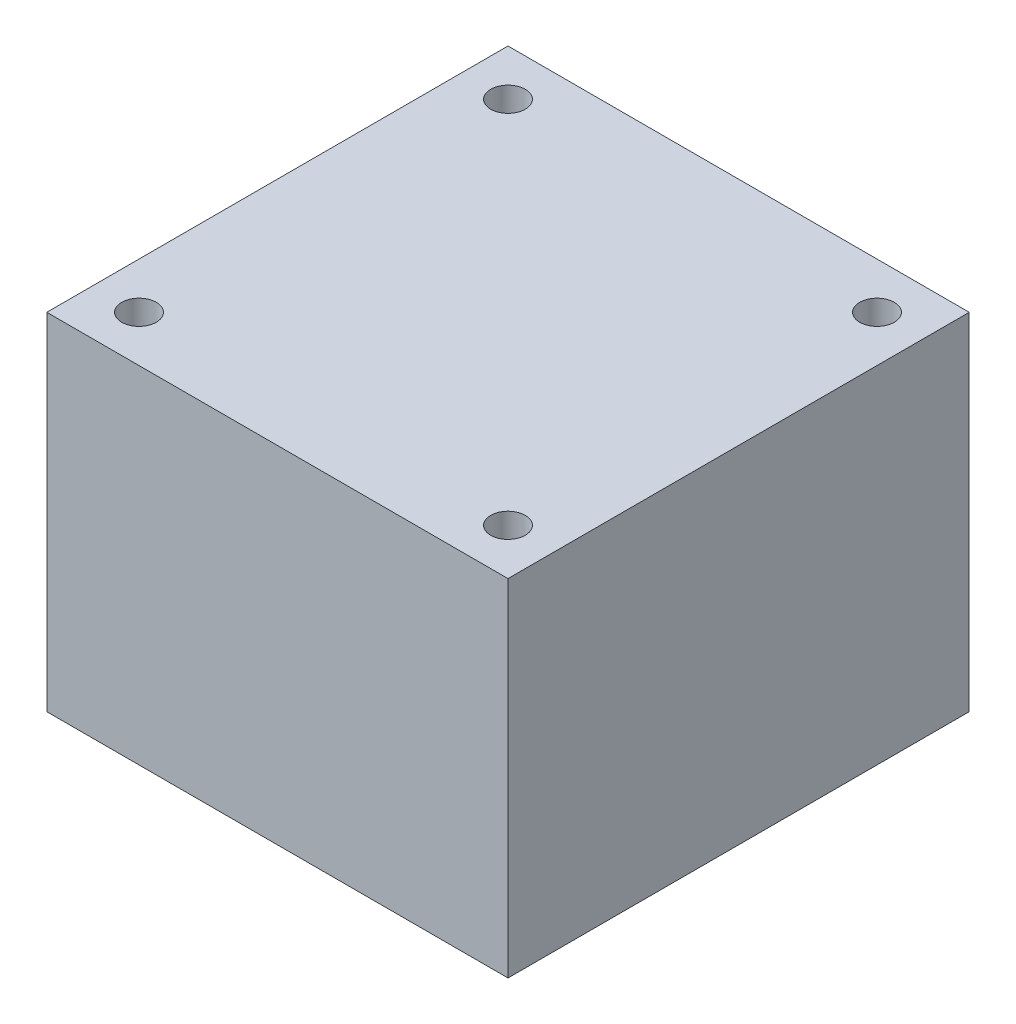
from build123d import *

# Parameters (mm, degrees)
SKETCH_1_W          = 40
SKETCH_1_H          = 40
EXTRUDE_1_DEPTH     = 30
SKETCH_2_R          = 1.5
CUT_EXTRUDE_1_DEPTH = 42.231056256


with BuildPart() as part:
    # 草图1 → 凸台-拉伸1 (new body)
    with BuildSketch(Plane(origin=(0, 0, 0), x_dir=(1, 0, 0), z_dir=(0, 1, 0))):
        Rectangle(SKETCH_1_W, SKETCH_1_H)
    extrude(amount=EXTRUDE_1_DEPTH)

    # 草图2 → 切除-拉伸1 (cut, through all)
    with BuildSketch(Plane(origin=(0, 30, 0), x_dir=(1, 0, 0), z_dir=(0, 1, 0))):
        with Locations(Location((-16, 16, 0), (0, 0, 270))):
            Circle(SKETCH_2_R)
        with Locations(Location((16, 16, 0), (0, 0, 270))):
            Circle(SKETCH_2_R)
        with Locations(Location((16, -16, 0), (0, 0, 270))):
            Circle(SKETCH_2_R)
        with Locations(Location((-16, -16, 0), (0, 0, 270))):
            Circle(SKETCH_2_R)
    extrude(amount=-CUT_EXTRUDE_1_DEPTH, mode=Mode.SUBTRACT)


solid = part.part
